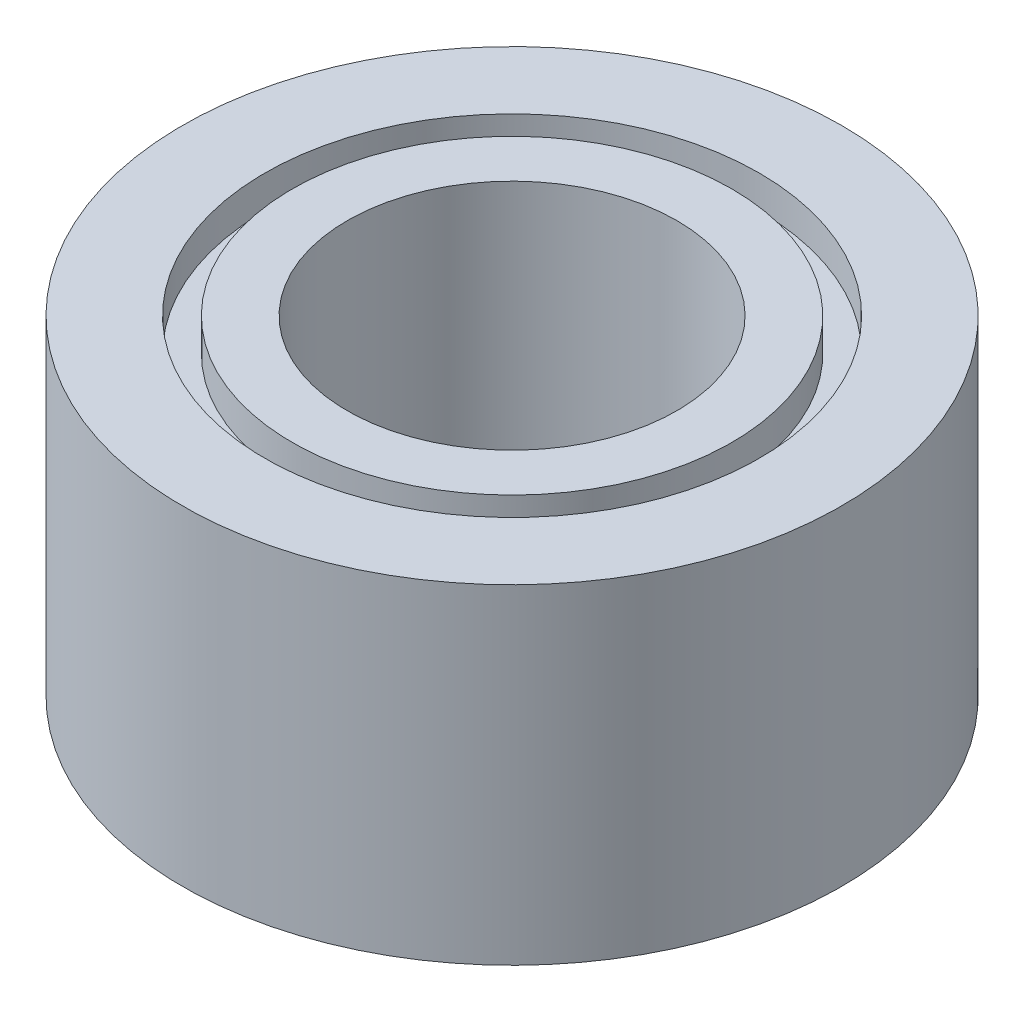
from build123d import *


with BuildPart() as part:
    # 草图1 → 旋转1 (revolve)
    with BuildSketch(Plane(origin=(0, 0, 0), x_dir=(0, 0, -1), z_dir=(1, 0, 0)), mode=Mode.PRIVATE) as revolve_1_sk:
        Polygon((-1.5, -1.5), (-2, -1.5), (-2, -1.2), (-2.25, -1.2), (-2.25, -1.5), (-3, -1.5), (-3, 1.5), (-2.25, 1.5), (-2.25, 1.2), (-2, 1.2), (-2, 1.5), (-1.5, 1.5), align=None)
    revolve(revolve_1_sk.sketch.rotate(Axis((0, 0, 0), (0, 1, 0)), 180), axis=Axis((0, 0, 0), (0, 1, 0)))


solid = part.part
